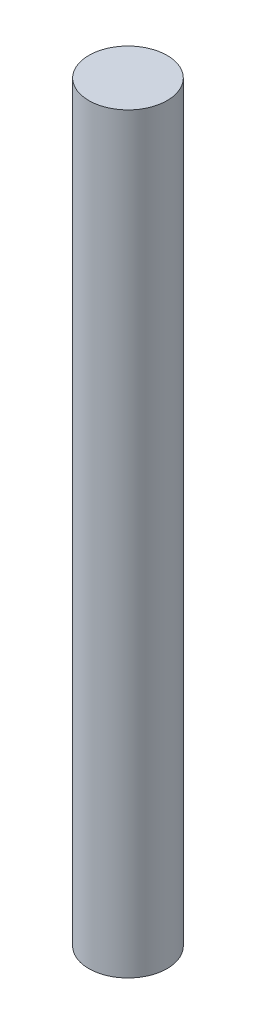
from build123d import *

# Parameters (mm, degrees)
SKETCH1_R           = 12.5
BOSS_EXTRUDE1_DEPTH = 240


with BuildPart() as part:
    # Sketch1 → Boss-Extrude1 (new body)
    with BuildSketch(Plane(origin=(0, 0, 0), x_dir=(1, 0, 0), z_dir=(0, 1, 0))):
        with Locations(Location((0, 0, 0), (0, 0, 270))):
            Circle(SKETCH1_R)
    extrude(amount=BOSS_EXTRUDE1_DEPTH)


solid = part.part
